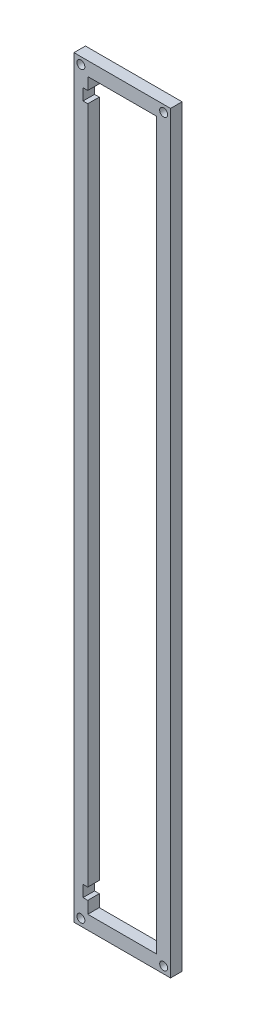
from build123d import *

# Parameters (mm, degrees)
SKETCH1_W                   = 53.34
SKETCH1_H                   = 415.925
BOSS_EXTRUDE2_DEPTH         = 6.35
SKETCH2_W                   = 38.1
SKETCH2_H                   = 400.685
CUT_EXTRUDE1_DEPTH          = 448.967600787
F_17_0_173_DIAMETER_HOLE1_D = 4.3942
CUT_EXTRUDE2_DEPTH          = 448.967600787
CUT_EXTRUDE2_DEPTH_BACK     = 448.967600787
SKETCH5_W                   = 2.619375
SKETCH5_H                   = 6.35


with BuildPart() as part:
    # Sketch1 → Boss-Extrude2 (new body)
    with BuildSketch(Plane.XY):
        with Locations((-148.231422107, 204.401588398)):
            Rectangle(SKETCH1_W, SKETCH1_H)
    extrude(amount=BOSS_EXTRUDE2_DEPTH)

    # Sketch2 → Cut-Extrude1 (cut, through all)
    with BuildSketch(Plane(origin=(0, 0, 0), x_dir=(-1, 0, 0), z_dir=(0, 0, -1))):
        with Locations((148.231422107, 204.401588398)):
            Rectangle(SKETCH2_W, SKETCH2_H)
    extrude(amount=-CUT_EXTRUDE1_DEPTH, mode=Mode.SUBTRACT)

    # #17 (0.173) Diameter Hole1 (through all)
    with Locations(Plane(origin=(0, 0, 0), x_dir=(-1, 0, 0), z_dir=(0, 0, -1))):
        with Locations((171.091422107, 408.554088398), (148.231422107, 204.401588398), (171.091422107, 0.249088398), (125.371422107, 408.554088398), (125.371422107, 0.249088398)):
            Hole(F_17_0_173_DIAMETER_HOLE1_D / 2)

    # Sketch5 → Cut-Extrude2 (cut, two sides: drawn at the far end of the back side and taken through both)
    with BuildSketch(Plane.XY.offset(6.35).offset(-CUT_EXTRUDE2_DEPTH_BACK)):
        with Locations((-168.591109607, 394.901588398)):
            Rectangle(SKETCH5_W, SKETCH5_H)
        with Locations((-168.591109607, 13.901588398)):
            Rectangle(SKETCH5_W, SKETCH5_H)
    extrude(amount=CUT_EXTRUDE2_DEPTH + CUT_EXTRUDE2_DEPTH_BACK, mode=Mode.SUBTRACT)


solid = part.part
